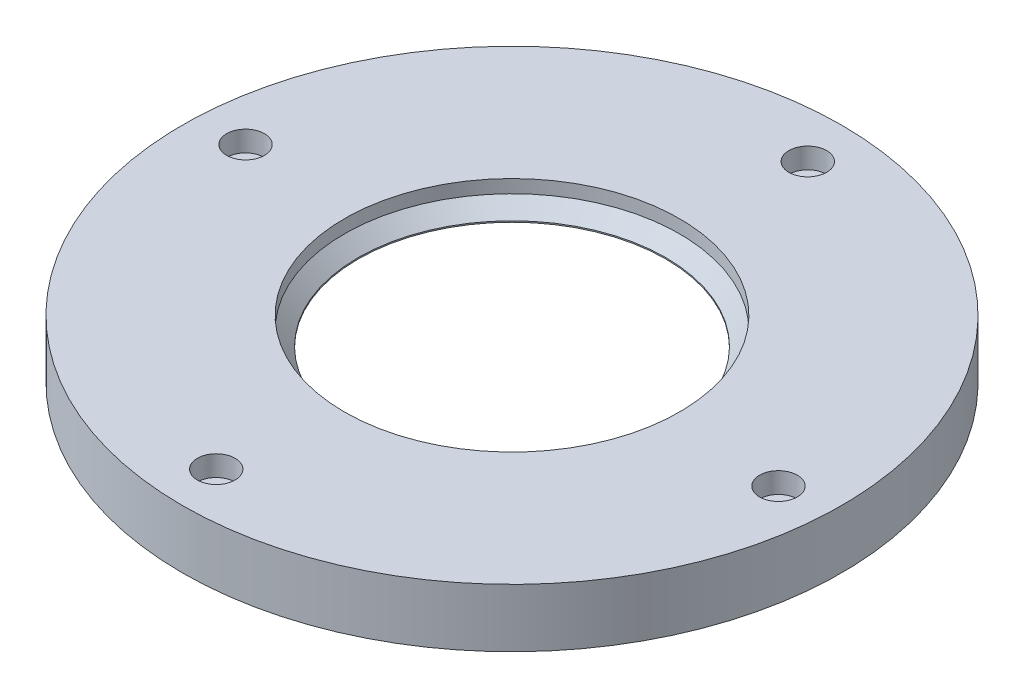
from build123d import *

# Parameters (mm, degrees)
FILLET1_R                        = 1
CBORE_FOR_M2_5_SHCS1_D           = 2.9
CBORE_FOR_M2_5_SHCS1_DEPTH       = 10
CBORE_FOR_M2_5_SHCS1_CBORE_D     = 5.5
CBORE_FOR_M2_5_SHCS1_CBORE_DEPTH = 3
CBORE_FOR_M2_5_SHCS1_TIP         = 0.871247898


with BuildPart() as part:
    # Sketch2 → Revolve1 (revolve)
    with BuildSketch(Plane(origin=(0, -49.046586852, 0), x_dir=(0.998643062566617, 0, 0.052077188744861835), z_dir=(-0.052077188744861835, 0, 0.998643062566617)), mode=Mode.PRIVATE) as revolve1_sk:
        Polygon((-25.6, 4.4), (-22.4, 4.4), (-22.4, 4.584314575), (-24.4, 6.584314575), (-24.4, 8.5), (-48, 8.5), (-48, 0), (-34, 0), (-34, 2), (-27.9, 2), (-27.9, 7), (-25.6, 7), align=None)
    revolve(revolve1_sk.sketch.rotate(Axis((0, -35.16651105, 0), (0, -1, 0)), 267.014846532), axis=Axis((0, -35.16651105, 0), (0, -1, 0)))

    # Fillet1
    fillet1_edges = [part.edges().sort_by_distance(p)[0] for p in [
        (0, -47.046586852, -34),
    ]]
    fillet(fillet1_edges, radius=FILLET1_R)

    # CBORE for M2.5 SHCS1
    with Locations(Plane(origin=(0, -40.546586852, 0), x_dir=(1, 0, 0), z_dir=(0, 1, 0))):
        with Locations((2.135164739, 40.944365565), (40.944365565, -2.135164739), (-40.944365565, 2.135164739), (-2.135164739, -40.944365565)):
            CounterBoreHole(CBORE_FOR_M2_5_SHCS1_D / 2, CBORE_FOR_M2_5_SHCS1_CBORE_D / 2, CBORE_FOR_M2_5_SHCS1_CBORE_DEPTH, depth=CBORE_FOR_M2_5_SHCS1_DEPTH)
            with Locations((0, 0, -(CBORE_FOR_M2_5_SHCS1_DEPTH + CBORE_FOR_M2_5_SHCS1_TIP / 2))):  # 118° drill point
                Cone(0, CBORE_FOR_M2_5_SHCS1_D / 2, CBORE_FOR_M2_5_SHCS1_TIP, mode=Mode.SUBTRACT)


solid = part.part
